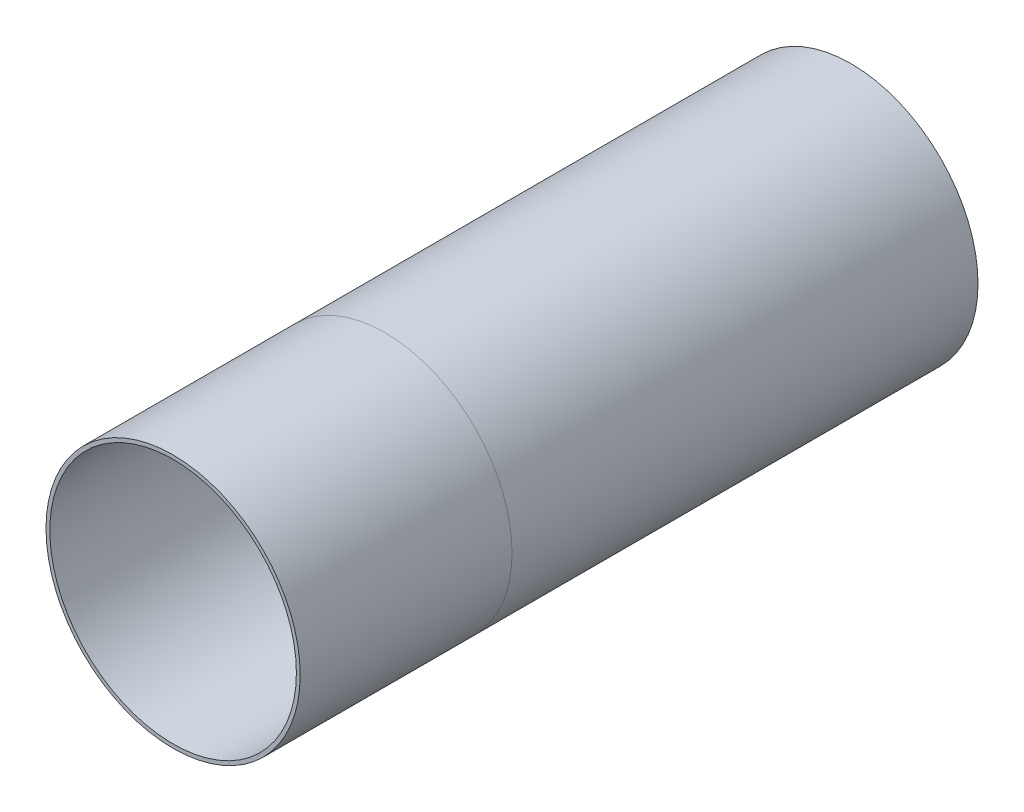
from build123d import *

# Parameters (mm, degrees)
ESQUISSE2_R        = 76.1746
ESQUISSE2_R_2      = 73.914
BOSS_EXTRU_1_DEPTH = 279.4
ESQUISSE3_R        = 76.2
ESQUISSE3_R_2      = 73.914
BOSS_EXTRU_2_DEPTH = 127


with BuildPart() as part:
    # Esquisse2 → Boss.-Extru.1 (new body)
    with BuildSketch(Plane.XY):
        Circle(ESQUISSE2_R)
        Circle(ESQUISSE2_R_2, mode=Mode.SUBTRACT)
    extrude(amount=BOSS_EXTRU_1_DEPTH)

    # Esquisse3 → Boss.-Extru.2 (add)
    with BuildSketch(Plane.XY.offset(279.4)):
        Circle(ESQUISSE3_R)
        Circle(ESQUISSE3_R_2, mode=Mode.SUBTRACT)
    extrude(amount=BOSS_EXTRU_2_DEPTH)


solid = part.part
